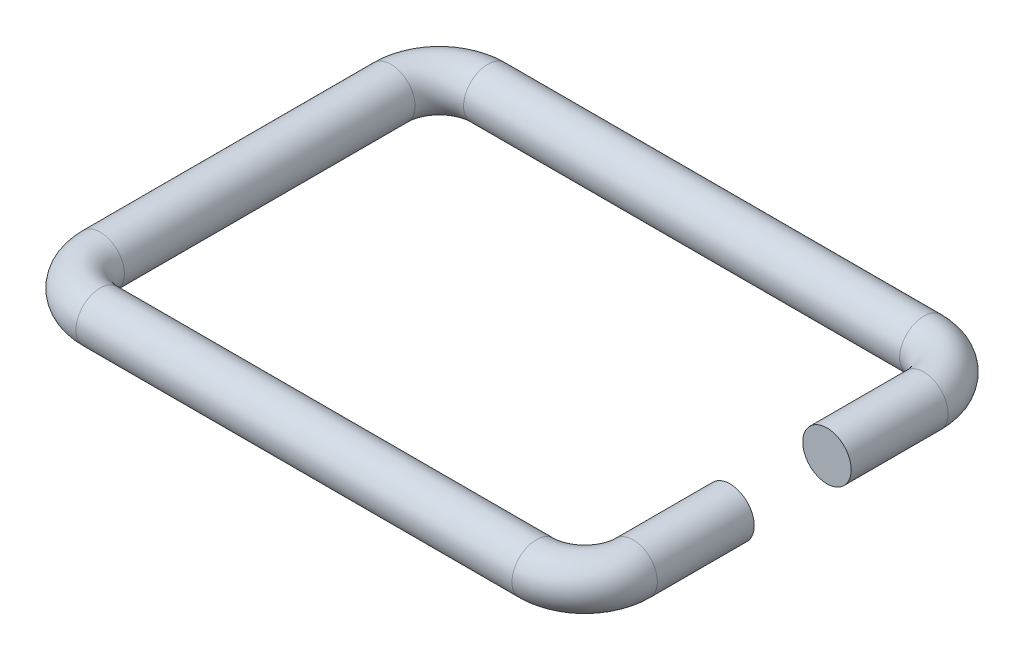
from build123d import *

# Parameters (mm, degrees)
ESQUISSE1_R = 1.25


with BuildPart() as part:
    # Balayage1: sweep along a path in Esquisse2
    with BuildLine(Plane(origin=(0, 0, 0), x_dir=(1, 0, 0), z_dir=(0, 1, 0))) as balayage1_path:
        Line((0, 0), (0, 5))
        ThreePointArc((0, 5), (-0.732233047, 6.767766953), (-2.5, 7.5))
        Line((-2.5, 7.5), (-25, 7.5))
        ThreePointArc((-25, 7.5), (-26.767766953, 6.767766953), (-27.5, 5))
        Line((-27.5, 5), (-27.5, -10))
        ThreePointArc((-27.5, -10), (-26.767766953, -11.767766953), (-25, -12.5))
        Line((-25, -12.5), (-2.5, -12.5))
        ThreePointArc((-2.5, -12.5), (-0.732233047, -11.767766953), (0, -10))
        Line((0, -10), (0, -5))
    # Esquisse1 → Balayage1 (sweep)
    with BuildSketch(Plane.XY):
        Circle(ESQUISSE1_R)
    sweep(path=balayage1_path.line)


solid = part.part
